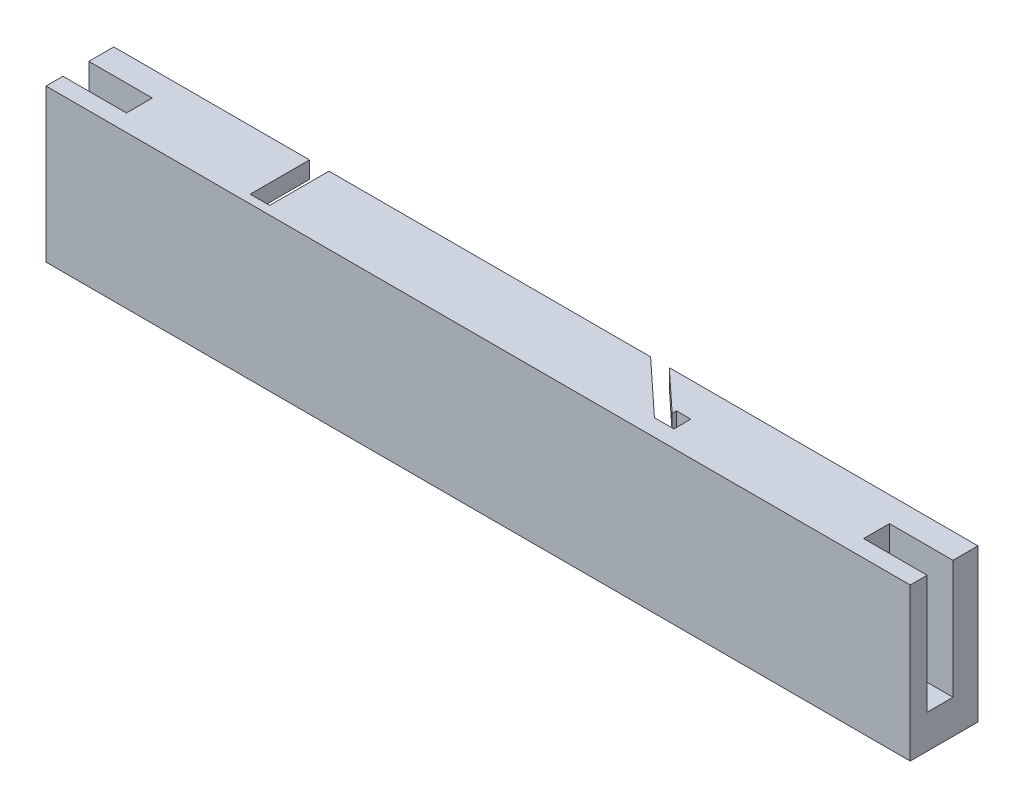
from build123d import *

# Parameters (mm, degrees)
SKETCH1_W            = 102
SKETCH1_H            = 18
BOSS_EXTRUDE1_DEPTH  = 2
BOSS_EXTRUDE2_DEPTH  = 18
SKETCH4_W            = 81
SKETCH4_H            = 2
BOSS_EXTRUDE3_DEPTH  = 6
SKETCH5_W            = 2.3
SKETCH5_H            = 2
SKETCH5_W_2          = 1.7
CUT_EXTRUDE1_DEPTH   = 6
SKETCH6_W            = 1.7
SKETCH6_H            = 2
BOSS_EXTRUDE4_DEPTH  = 4
CUT_EXTRUDE2_DEPTH   = 20
SKETCH8_W            = 2
SKETCH8_H            = 6
BOSS_EXTRUDE5_DEPTH  = 1
SKETCH10_W           = 3.5
SKETCH10_H           = 6
BOSS_EXTRUDE6_DEPTH  = 1
SKETCH11_W           = 1.5
SKETCH11_H           = 6
BOSS_EXTRUDE7_DEPTH  = 8
BOSS_EXTRUDE8_DEPTH  = 6
RIB1_REACH           = 54.402
SKETCH17_WALL_W      = 117.434725866
SKETCH17_WALL_H      = 4
CHAMFER1_SIZE        = 0.5
SKETCH18_W           = 7.5
SKETCH18_H           = 3.05
BOSS_EXTRUDE10_DEPTH = 4
SKETCH19_W           = 26.1754507
SKETCH19_H           = 11
CUT_EXTRUDE3_DEPTH   = 1
SKETCH20_W           = 2.3
SKETCH20_H           = 1
CUT_EXTRUDE4_DEPTH   = 21


with BuildPart() as part:
    # Sketch1 → Boss-Extrude1 (new body)
    with BuildSketch(Plane.XY):
        Rectangle(SKETCH1_W, SKETCH1_H)
    extrude(amount=BOSS_EXTRUDE1_DEPTH)

    # Sketch2 → Boss-Extrude2 (add)
    with BuildSketch(Plane(origin=(0, 9, 0), x_dir=(1, 0, 0), z_dir=(0, 1, 0))):
        Polygon((-43.5, 0), (-40.5, 0), (-40.5, 6), (-51, 6), (-51, 3.05), (-43.5, 3.05), align=None)
        Polygon((40.5, 6), (40.5, 0), (43.5, 0), (43.5, 3.05), (51, 3.05), (51, 6), align=None)
    extrude(amount=-BOSS_EXTRUDE2_DEPTH)

    # Sketch4 → Boss-Extrude3 (add)
    with BuildSketch(Plane(origin=(0, 0, 0), x_dir=(-1, 0, 0), z_dir=(0, 0, -1))):
        with Locations((0, 8)):
            Rectangle(SKETCH4_W, SKETCH4_H)
        with Locations((0, -8)):
            Rectangle(SKETCH4_W, SKETCH4_H)
    extrude(amount=BOSS_EXTRUDE3_DEPTH)

    # Sketch5 → Cut-Extrude1 (cut)
    with BuildSketch(Plane(origin=(0, 0, -6), x_dir=(-1, 0, 0), z_dir=(0, 0, -1))):
        with Locations((26.75, -8)):
            Rectangle(SKETCH5_W, SKETCH5_H)
        with Locations((26.75, 8)):
            Rectangle(SKETCH5_W, SKETCH5_H)
        with Locations((-20.25, 8)):
            Rectangle(SKETCH5_W_2, SKETCH5_H)
        with Locations((-20.25, -8)):
            Rectangle(SKETCH5_W_2, SKETCH5_H)
    extrude(amount=-CUT_EXTRUDE1_DEPTH, mode=Mode.SUBTRACT)

    # Sketch6 → Boss-Extrude4 (add)
    with BuildSketch(Plane(origin=(0, 0, -6), x_dir=(-1, 0, 0), z_dir=(0, 0, -1))):
        with Locations((-20.25, 8)):
            Rectangle(SKETCH6_W, SKETCH6_H)
        with Locations((-20.25, -8)):
            Rectangle(SKETCH6_W, SKETCH6_H)
    extrude(amount=-BOSS_EXTRUDE4_DEPTH)

    # Sketch7 → Cut-Extrude2 (cut)
    with BuildSketch(Plane(origin=(0, 9, 0), x_dir=(1, 0, 0), z_dir=(0, 1, 0))):
        Polygon((18.810082021, 0), (12.361738872, 6), (14.563742638, 6), (19.4, 1.5), (20.041328573, 1.5), (20.041328573, 0), align=None)
    extrude(amount=-CUT_EXTRUDE2_DEPTH, mode=Mode.SUBTRACT)

    # Sketch8 → Boss-Extrude5 (add)
    with BuildSketch(Plane(origin=(0, 0, 0), x_dir=(-1, 0, 0), z_dir=(0, 0, -1))):
        with Locations((33.75, 0)):
            Rectangle(SKETCH8_W, SKETCH8_H)
    extrude(amount=BOSS_EXTRUDE5_DEPTH)

    # Sketch10 → Boss-Extrude6 (add)
    with BuildSketch(Plane(origin=(0, 0, -1), x_dir=(-1, 0, 0), z_dir=(0, 0, -1))):
        with Locations((33, 0)):
            Rectangle(SKETCH10_W, SKETCH10_H)
    extrude(amount=BOSS_EXTRUDE6_DEPTH)

    # Sketch11 → Boss-Extrude7 (add)
    with BuildSketch(Plane(origin=(0, 0, 0), x_dir=(-1, 0, 0), z_dir=(0, 0, -1))):
        with Locations((5.8, 0)):
            Rectangle(SKETCH11_W, SKETCH11_H)
    extrude(amount=BOSS_EXTRUDE7_DEPTH)

    # Sketch12 → Boss-Extrude8 (add)
    with BuildSketch(Plane.XZ.offset(3)):
        Polygon((-6.55, -8), (-7.55, -6), (-6.55, -6), align=None)
    extrude(amount=-BOSS_EXTRUDE8_DEPTH)

    # Sketch17 wall → Rib1 (add, up to next)
    with BuildSketch(Plane(origin=(-1.55, 0, -4), x_dir=(0.658504607869, 0, 0.752576694707), z_dir=(0.752576694707, 0, -0.658504607869)), mode=Mode.PRIVATE) as rib1_sk1:
        Rectangle(SKETCH17_WALL_W, SKETCH17_WALL_H)
    rib1_tool1 = extrude(rib1_sk1.sketch, amount=-RIB1_REACH, mode=Mode.PRIVATE) - part.part
    add(rib1_tool1.solids().sort_by_distance((-1.55, 0, -4))[0])

    # Chamfer1
    chamfer1_edges = [part.edges().sort_by_distance(p)[0] for p in [
        (-31.25, 0, -1),
    ]]
    chamfer(chamfer1_edges, length=CHAMFER1_SIZE)

    # Sketch18 → Boss-Extrude10 (add)
    with BuildSketch(Plane.XZ.offset(9)):
        with Locations((47.25, -1.525)):
            Rectangle(SKETCH18_W, SKETCH18_H)
        with Locations((-47.25, -1.525)):
            Rectangle(SKETCH18_W, SKETCH18_H)
    extrude(amount=-BOSS_EXTRUDE10_DEPTH)

    # Sketch19 → Cut-Extrude3 (cut)
    with BuildSketch(Plane(origin=(0, 0, 0), x_dir=(-1, 0, 0), z_dir=(0, 0, -1))):
        with Locations((19.63772535, 0)):
            Rectangle(SKETCH19_W, SKETCH19_H)
    extrude(amount=-CUT_EXTRUDE3_DEPTH, mode=Mode.SUBTRACT)

    # Sketch20 → Cut-Extrude4 (cut)
    with BuildSketch(Plane(origin=(0, 9, 0), x_dir=(1, 0, 0), z_dir=(0, 1, 0))):
        with Locations((-26.75, -0.5)):
            Rectangle(SKETCH20_W, SKETCH20_H)
    extrude(amount=-CUT_EXTRUDE4_DEPTH, mode=Mode.SUBTRACT)


solid = part.part
